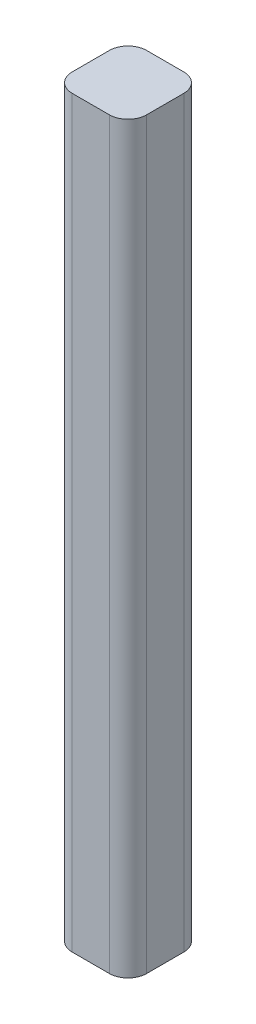
from build123d import *

# Parameters (mm, degrees)
RESSALTO_EXTRUS_O1_DEPTH = 80


with BuildPart() as part:
    # Esboço1 → Ressalto-extrusão1 (new body)
    with BuildSketch(Plane(origin=(0, 0, 0), x_dir=(1, 0, 0), z_dir=(0, 1, 0))):
        with BuildLine():
            Line((-2, -4), (2, -4))
            ThreePointArc((2, -4), (3.414213562, -3.414213562), (4, -2))
            Line((4, -2), (4, 2))
            ThreePointArc((4, 2), (3.414213562, 3.414213562), (2, 4))
            Line((2, 4), (-2, 4))
            ThreePointArc((-2, 4), (-3.414213562, 3.414213562), (-4, 2))
            Line((-4, 2), (-4, -2))
            ThreePointArc((-4, -2), (-3.414213562, -3.414213562), (-2, -4))
        make_face()
    extrude(amount=RESSALTO_EXTRUS_O1_DEPTH)


solid = part.part
